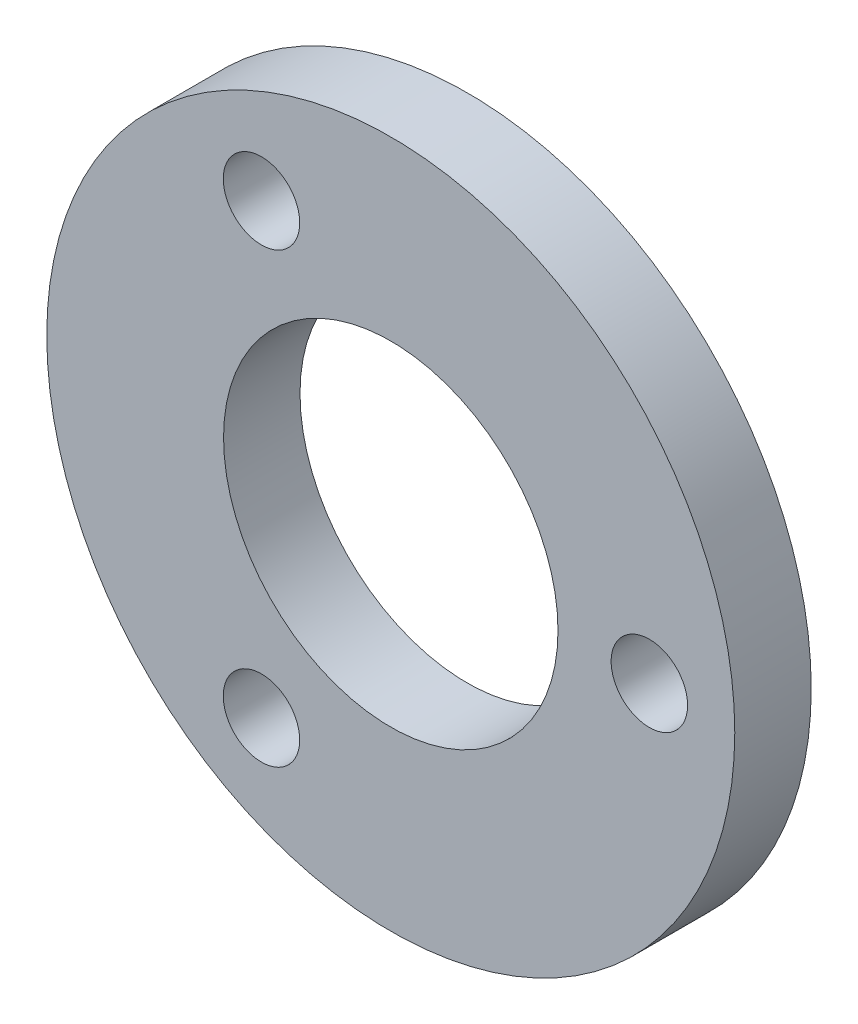
from build123d import *

# Parameters (mm, degrees)
SKETCH_1_R      = 18
SKETCH_1_R_2    = 8.75
SKETCH_1_R_3    = 2
EXTRUDE_1_DEPTH = 4


with BuildPart() as part:
    # 草图1 → 凸台-拉伸1 (new body)
    with BuildSketch(Plane.XY):
        with Locations((-0.736666667, 0.091402557)):
            Circle(SKETCH_1_R)
        with Locations((-0.736666667, 0.091402557)):
            Circle(SKETCH_1_R_2, mode=Mode.SUBTRACT)
        with Locations((12.793333333, 0.091402557)):
            Circle(SKETCH_1_R_3, mode=Mode.SUBTRACT)
        with Locations((-7.501666667, -11.625921157)):
            Circle(SKETCH_1_R_3, mode=Mode.SUBTRACT)
        with Locations((-7.501666667, 11.80872627)):
            Circle(SKETCH_1_R_3, mode=Mode.SUBTRACT)
    extrude(amount=EXTRUDE_1_DEPTH)


solid = part.part
